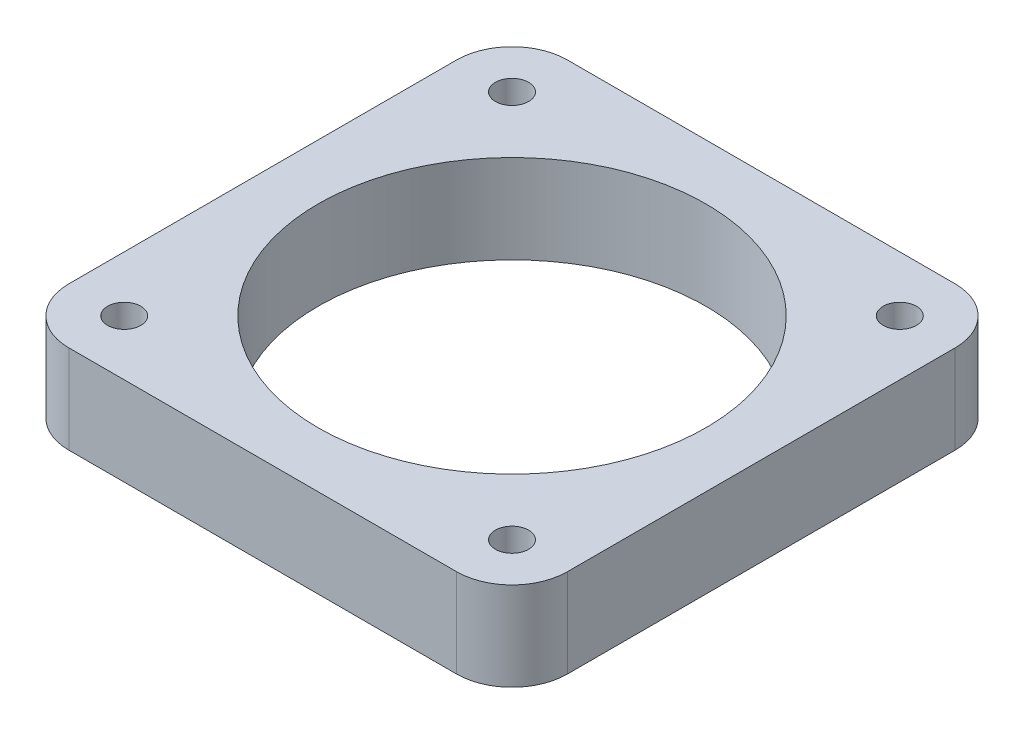
from build123d import *

# Parameters (mm, degrees)
SKETCH1_W           = 45
SKETCH1_H           = 45
SKETCH1_R           = 17.5
SKETCH1_R_2         = 1.5
BOSS_EXTRUDE1_DEPTH = 8
FILLET1_R           = 5


with BuildPart() as part:
    # Sketch1 → Boss-Extrude1 (new body)
    with BuildSketch(Plane(origin=(0, 0, 0), x_dir=(1, 0, 0), z_dir=(0, 1, 0))):
        Rectangle(SKETCH1_W, SKETCH1_H)
        with Locations(Location((0, 0, 0), (0, 0, 270))):
            Circle(SKETCH1_R, mode=Mode.SUBTRACT)
        with Locations(Location((-17.5, 17.5, 0), (0, 0, 270))):
            Circle(SKETCH1_R_2, mode=Mode.SUBTRACT)
        with Locations(Location((17.5, 17.5, 0), (0, 0, 270))):
            Circle(SKETCH1_R_2, mode=Mode.SUBTRACT)
        with Locations(Location((17.5, -17.5, 0), (0, 0, 270))):
            Circle(SKETCH1_R_2, mode=Mode.SUBTRACT)
        with Locations(Location((-17.5, -17.5, 0), (0, 0, 270))):
            Circle(SKETCH1_R_2, mode=Mode.SUBTRACT)
    extrude(amount=BOSS_EXTRUDE1_DEPTH)

    # Fillet1
    fillet1_edges = [part.edges().sort_by_distance(p)[0] for p in [
        (-22.5, 4, 22.5),
        (-22.5, 4, -22.5),
        (22.5, 4, -22.5),
        (22.5, 4, 22.5),
    ]]
    fillet(fillet1_edges, radius=FILLET1_R)


solid = part.part
